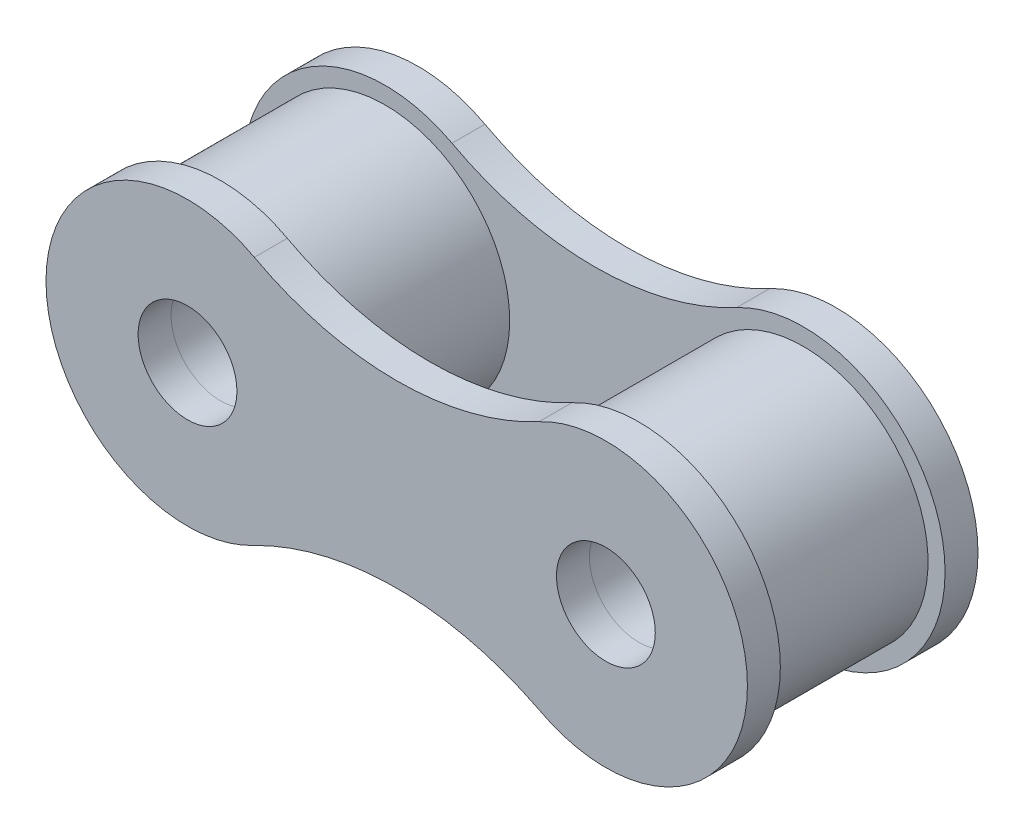
from build123d import *

# Parameters (mm, degrees)
SKETCH1_R             = 3.779761905
SKETCH1_R_2           = 1.511904762
BOSS_EXTRUDE1_DEPTH   = 2.5
BOSS_EXTRUDE1_2_DEPTH = 2.5
SKETCH2_R             = 1.5
BOSS_EXTRUDE2_DEPTH   = 1


with BuildPart() as part:
    # Sketch1 → Boss-Extrude1 (new, symmetric)
    with BuildSketch(Plane.XY):
        with Locations((-6.35, 0)):
            Circle(SKETCH1_R)
        with Locations((-6.35, 0)):
            Circle(SKETCH1_R_2, mode=Mode.SUBTRACT)
    extrude(amount=BOSS_EXTRUDE1_DEPTH, both=True)



with BuildPart() as body_2:
    # Sketch1 → Boss-Extrude1 2 (new, symmetric)
    with BuildSketch(Plane.XY):
        with Locations(Location((6.35, 0, 0), (0, 0, 180))):
            Circle(SKETCH1_R)
        with Locations(Location((6.35, 0, 0), (0, 0, 180))):
            Circle(SKETCH1_R_2, mode=Mode.SUBTRACT)
    extrude(amount=BOSS_EXTRUDE1_2_DEPTH, both=True)


with BuildPart() as part_1:
    add(part.part)

    add(body_2.part)  # Boss-Extrude2 merges body 2
    # Sketch2 → Boss-Extrude2 (add)
    with BuildSketch(Plane.XY.offset(-2.5)):
        with BuildLine():
            ThreePointArc((-4.321104387, 3.787065053), (-10.646309943, 0), (-4.321104387, -3.787065053))
            ThreePointArc((-4.321104387, -3.787065053), (0, -2.75), (4.321104387, -3.787065053))
            ThreePointArc((4.321104387, -3.787065053), (10.646309943, 0), (4.321104387, 3.787065053))
            ThreePointArc((4.321104387, 3.787065053), (0, 2.702484697), (-4.321104387, 3.787065053))
        make_face()
        with Locations((6.35, 0)):
            Circle(SKETCH2_R, mode=Mode.SUBTRACT)
        with Locations((-6.35, 0)):
            Circle(SKETCH2_R, mode=Mode.SUBTRACT)
    boss_extrude2 = extrude(amount=-BOSS_EXTRUDE2_DEPTH)

    # Mirror1: Boss-Extrude2 across plane
    add(boss_extrude2.mirror(Plane.XY))


solid = part_1.part
